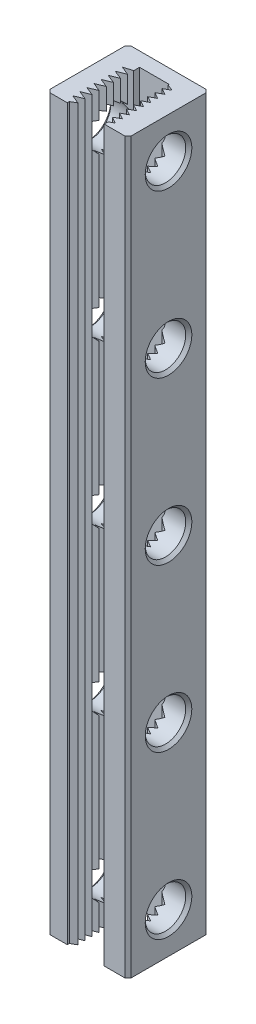
from build123d import *

# Parameters (mm, degrees)
SKETCH1_W                  = 8
SKETCH1_H                  = 8
BOSS_EXTRUDE1_DEPTH        = 300
CUT_EXTRUDE1_DEPTH         = 301.213257535
SKETCH3_R                  = 2
CUT_EXTRUDE2_DEPTH         = 301.213257535
CHAMFER1_SIZE              = 0.3
CHAMFER2_SIZE              = 0.3
LPATTERN1_COUNT            = 19
LPATTERN1_PITCH            = 16
CHAMFER1_OF_LPATTERN1_SIZE = 0.3
SKETCH4_W                  = 8
SKETCH4_H                  = 228
CUT_EXTRUDE3_DEPTH         = 301.213257535


with BuildPart() as part:
    # Sketch1 → Boss-Extrude1 (new body)
    with BuildSketch(Plane(origin=(0, 0, 0), x_dir=(1, 0, 0), z_dir=(0, 1, 0))):
        with Locations((4, 4)):
            Rectangle(SKETCH1_W, SKETCH1_H)
    extrude(amount=BOSS_EXTRUDE1_DEPTH)

    # Sketch2 → Cut-Extrude1 (cut, through all)
    with BuildSketch(Plane.XZ):
        Polygon((5.652029979, 0), (2.008445554, 0), (2.008445554, -0.208206305), (2.54, -0.515099407), (1.673719601, -0.865099407), (2.54, -1.215099407), (1.673719601, -1.572712655), (2.54, -1.915099407), (1.673719601, -2.265099407), (2.54, -2.615099407), (1.673719601, -2.965099407), (2.54, -3.315099407), (1.673719601, -3.665099407), (2.54, -4.015099407), (1.673719601, -4.365099407), (2.54, -4.715099407), (1.673719601, -5.065099407), (2.54, -5.415099407), (1.673719601, -5.765099407), (2.54, -6.026380467), (2.54, -6.6), (5.46, -6.6), (5.46, -6.49878106), (6.106693316, -6.2375), (5.46, -5.8875), (6.106693316, -5.5375), (5.46, -5.1875), (6.106693316, -4.8375), (5.46, -4.4875), (6.106693316, -4.1375), (5.46, -3.7875), (6.106693316, -3.4375), (5.46, -3.0875), (6.106693316, -2.7375), (5.46, -2.3875), (6.106693316, -2.0375), (5.46, -1.6875), (6.106693316, -1.345113247), (5.46, -0.9875), (6.106693316, -0.6375), (5.652029979, -0.375), align=None)
    extrude(amount=-CUT_EXTRUDE1_DEPTH, mode=Mode.SUBTRACT)

    # Sketch3 → Cut-Extrude2 (cut, through all)
    with BuildSketch(Plane(origin=(8, 0, 0), x_dir=(0, 0, -1), z_dir=(1, 0, 0))):
        with Locations((4, 4)):
            Circle(SKETCH3_R)
    cut_extrude2 = extrude(amount=-CUT_EXTRUDE2_DEPTH, mode=Mode.SUBTRACT)

    # Chamfer1
    chamfer1_edges = [part.edges().sort_by_distance(p)[0] for p in [
        (0, 4, -2),
        (8, 4, -2),
    ]]
    chamfer(chamfer1_edges, length=CHAMFER1_SIZE)

    # Chamfer2
    chamfer2_edges = [part.edges().sort_by_distance(p)[0] for p in [
        (0, 150, -8),
        (8, 150, -8),
        (8, 150, 0),
        (0, 150, 0),
    ]]
    chamfer(chamfer2_edges, length=CHAMFER2_SIZE)

    # LPattern1: Cut-Extrude2 ×19
    with Locations(*[(0, i * LPATTERN1_PITCH, 0) for i in range(1, LPATTERN1_COUNT)]):
        add(cut_extrude2, mode=Mode.SUBTRACT)

    # Chamfer1 of LPattern1
    chamfer1_of_lpattern1_edges = [part.edges().sort_by_distance(p)[0] for p in [
        (0, 20, -2),
        (8, 20, -2),
        (0, 36, -2),
        (8, 36, -2),
        (0, 52, -2),
        (8, 52, -2),
        (0, 68, -2),
        (8, 68, -2),
        (0, 84, -2),
        (8, 84, -2),
        (0, 100, -2),
        (8, 100, -2),
        (0, 116, -2),
        (8, 116, -2),
        (0, 132, -2),
        (8, 132, -2),
        (0, 148, -2),
        (8, 148, -2),
        (0, 164, -2),
        (8, 164, -2),
        (0, 180, -2),
        (8, 180, -2),
        (0, 196, -2),
        (8, 196, -2),
        (0, 212, -2),
        (8, 212, -2),
        (0, 228, -2),
        (8, 228, -2),
        (0, 244, -2),
        (8, 244, -2),
        (0, 260, -2),
        (8, 260, -2),
        (0, 276, -2),
        (8, 276, -2),
        (0, 292, -2),
        (8, 292, -2),
    ]]
    chamfer(chamfer1_of_lpattern1_edges, length=CHAMFER1_OF_LPATTERN1_SIZE)

    # Sketch4 → Cut-Extrude3 (cut, through all)
    with BuildSketch(Plane(origin=(8, 0, 0), x_dir=(0, 0, -1), z_dir=(1, 0, 0))):
        with Locations((4, 186)):
            Rectangle(SKETCH4_W, SKETCH4_H)
    extrude(amount=-CUT_EXTRUDE3_DEPTH, mode=Mode.SUBTRACT)


solid = part.part
